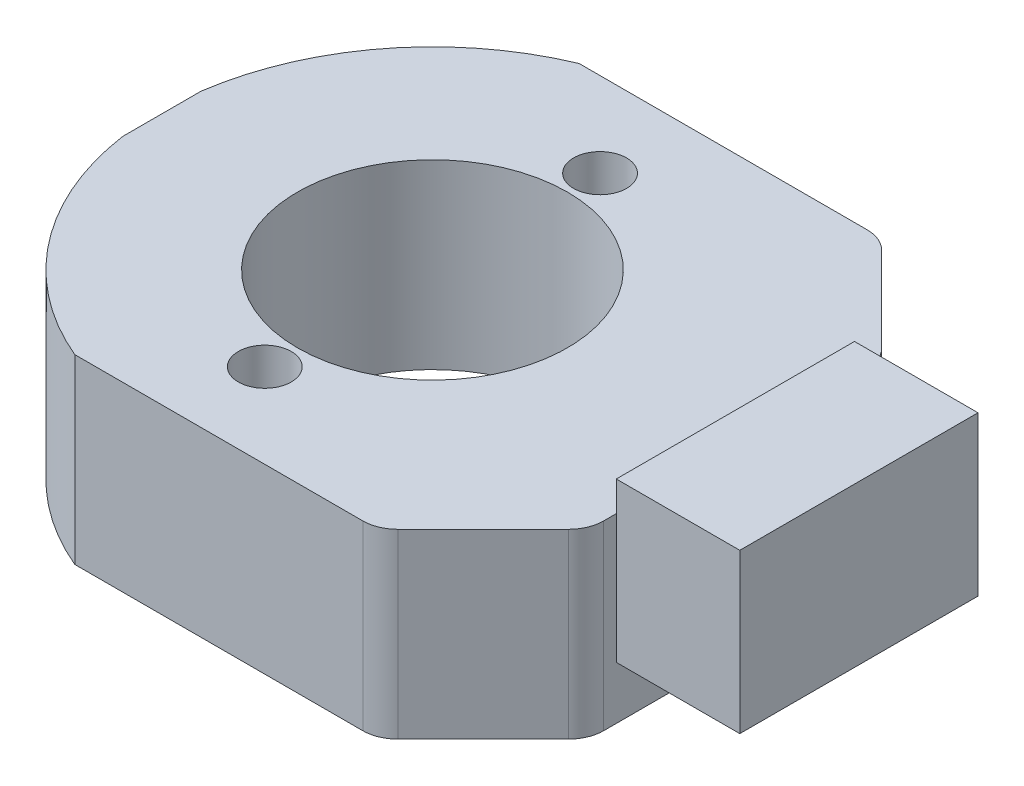
from build123d import *

# Parameters (mm, degrees)
SKETCH_1_R          = 7.65
EXTRUDE_1_DEPTH     = 10.3
SKETCH_2_R          = 1.5
CUT_EXTRUDE_1_DEPTH = 10.5
CHAMFER_1_SIZE      = 6
FILLET_1_R          = 2
EXTRUDE_START       = 3
SKETCH_4_W          = 7
SKETCH_4_H          = 13.5
EXTRUDE_2_DEPTH     = 9


with BuildPart() as part:
    # ｽｹｯﾁ1 → ﾎﾞｽ - 押し出し1 (new body)
    with BuildSketch(Plane(origin=(0, 0, 0), x_dir=(1, 0, 0), z_dir=(0, 1, 0))):
        with BuildLine():
            Line((17.17, 14.29), (-5.977959518, 14.29))
            ThreePointArc((-5.977959518, 14.29), (-12.244374402, 9.48764436), (-15.33, 2.220630541))
            Line((-15.33, 2.220630541), (-15.33, -2.220630541))
            ThreePointArc((-15.33, -2.220630541), (-12.244374402, -9.48764436), (-5.977959518, -14.29))
            Line((-5.977959518, -14.29), (17.17, -14.29))
            Line((17.17, -14.29), (17.17, 14.29))
        make_face()
        with Locations(Location((0, 0, 0), (0, 0, 90))):
            Circle(SKETCH_1_R, mode=Mode.SUBTRACT)
    extrude(amount=EXTRUDE_1_DEPTH)

    # ｽｹｯﾁ2 → ｶｯﾄ - 押し出し1 (cut)
    with BuildSketch(Plane.XZ):
        with Locations(Location((0, 9.5, 0), (0, 0, 270))):
            Circle(SKETCH_2_R)
        with Locations(Location((0, -9.5, 0), (0, 0, 270))):
            Circle(SKETCH_2_R)
    extrude(amount=-CUT_EXTRUDE_1_DEPTH, mode=Mode.SUBTRACT)

    # 面取り1
    chamfer_1_edges = [part.edges().sort_by_distance(p)[0] for p in [
        (17.17, 5.15, -14.29),
        (17.17, 5.15, 14.29),
    ]]
    chamfer(chamfer_1_edges, length=CHAMFER_1_SIZE)

    # ﾌｨﾚｯﾄ1
    fillet_1_edges = [part.edges().sort_by_distance(p)[0] for p in [
        (11.17, 5.15, -14.29),
        (17.17, 5.15, 8.29),
        (17.17, 5.15, -8.29),
        (11.17, 5.15, 14.29),
    ]]
    fillet(fillet_1_edges, radius=FILLET_1_R)

    # ｽｹｯﾁ4 → ﾎﾞｽ - 押し出し2 (add)
    with BuildSketch(Plane(origin=(0, 0, 0), x_dir=(1, 0, 0), z_dir=(0, 1, 0)).offset(EXTRUDE_START)):
        with Locations((20.67, 0)):
            Rectangle(SKETCH_4_W, SKETCH_4_H)
    extrude(amount=EXTRUDE_2_DEPTH)


solid = part.part
